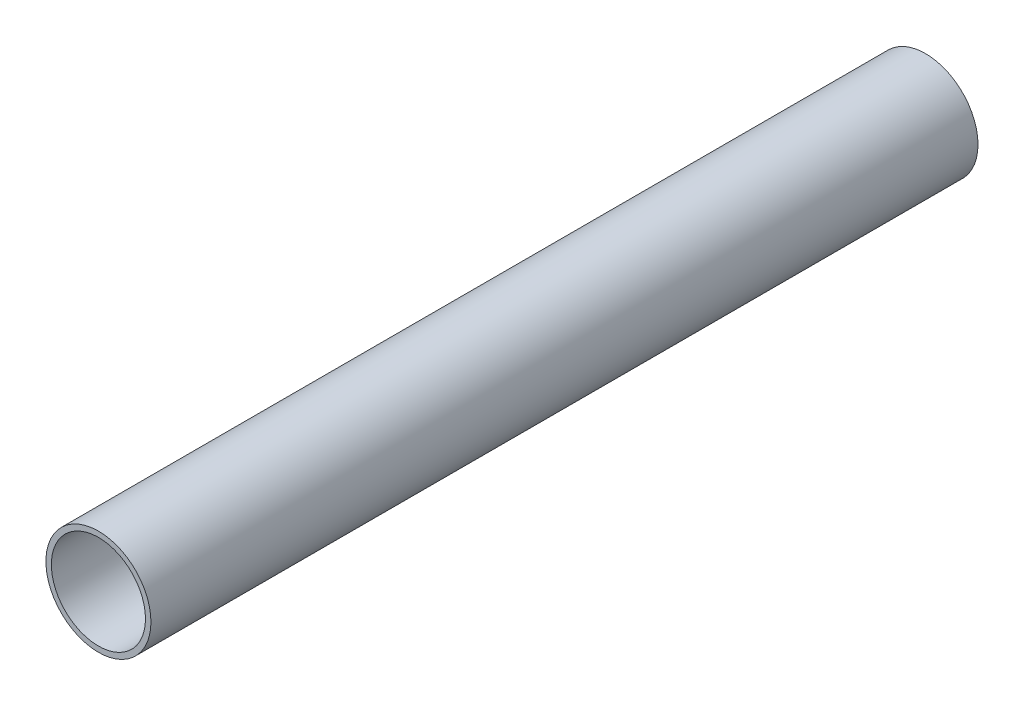
from build123d import *

# Parameters (mm, degrees)
SKETCH1_R           = 15.875
SKETCH1_R_2         = 14.224
BOSS_EXTRUDE1_DEPTH = 250


with BuildPart() as part:
    # Sketch1 → Boss-Extrude1 (new body)
    with BuildSketch(Plane.XY):
        Circle(SKETCH1_R)
        Circle(SKETCH1_R_2, mode=Mode.SUBTRACT)
    extrude(amount=BOSS_EXTRUDE1_DEPTH)


solid = part.part
